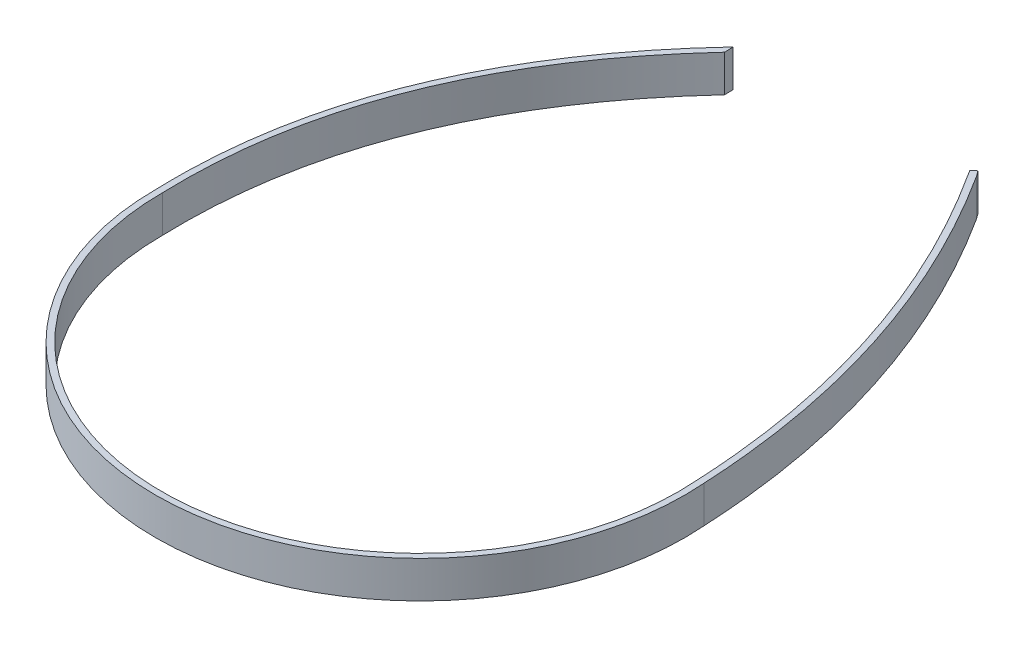
from build123d import *

# Parameters (mm, degrees)
EXTRUDE_1_DEPTH = 1.5


with BuildPart() as part:
    # 草图1 → 拉伸1 (new, symmetric)
    with BuildSketch(Plane(origin=(0, 0, 0), x_dir=(1, 0, 0), z_dir=(0, 1, 0))):
        with BuildLine():
            Line((20.940011064, 1.58846533), (20.939920521, 1.58736529))
            ThreePointArc((20.939920521, 1.58736529), (0.761777461, -20.986178668), (-20.999899431, 0.064991443))
            add(Edge.make_bspline(
                [(-8.051332909, 32.78715945), (-8.610349318, 32.182398754), (-9.714361715, 30.939196238), (-11.751951037, 28.441519755), (-14.028887881, 25.244274154), (-16.311662528, 21.307878415), (-18.150397892, 17.266249907), (-19.545128941, 13.120876546), (-20.496807064, 8.86508597), (-21.004475075, 4.530924038), (-21.049002229, 1.538986899), (-20.999899431, 0.064991443)],
                knots=[0.004872267, 0.004872267, 0.004872267, 0.004872267, 0.02895963, 0.053109791, 0.101410114, 0.149710437, 0.198010759, 0.246311082, 0.294611405, 0.342911728, 0.39069527, 0.39069527, 0.39069527, 0.39069527], degree=3))
            Line((-8.051332909, 32.78715945), (-8.072524116, 33.5))
            add(Edge.make_bspline(
                [(-8.072524116, 33.5), (-22.136696557, 18.527333844), (-21.5, 0)],
                knots=[0, 0, 0, 0.391212051, 0.391212051, 0.391212051], degree=2))
            ThreePointArc((-21.5, 0), (0.807061405, -21.48484703), (21.439409478, 1.612985193))
            add(Edge.make_bspline(
                [(10.927475884, 34.265791626), (20.575756572, 19.203087379), (21.439409478, 1.612985193)],
                knots=[0, 0, 0, 0.204404978, 0.204404978, 0.204404978], degree=2))
            Line((10.927475884, 34.265791626), (10.588152757, 34.734289031))
            Line((10.588152757, 34.734289031), (10.236755206, 34.417135424))
            add(Edge.make_bspline(
                [(10.236755206, 34.417135424), (11.041253847, 33.161168119), (12.610265397, 30.600103215), (15.317060933, 25.402889951), (18.018451366, 18.698039733), (19.779296418, 11.724493606), (20.629070045, 5.992876218), (20.868076786, 3.053557708), (20.940011064, 1.58846533)],
                knots=[-0.002856761, -0.002856761, -0.002856761, -0.002856761, 0.023050957, 0.048958674, 0.100774109, 0.152589544, 0.178497261, 0.204404978, 0.204404978, 0.204404978, 0.204404978], degree=3))
        make_face()
    extrude(amount=EXTRUDE_1_DEPTH, both=True)


solid = part.part
